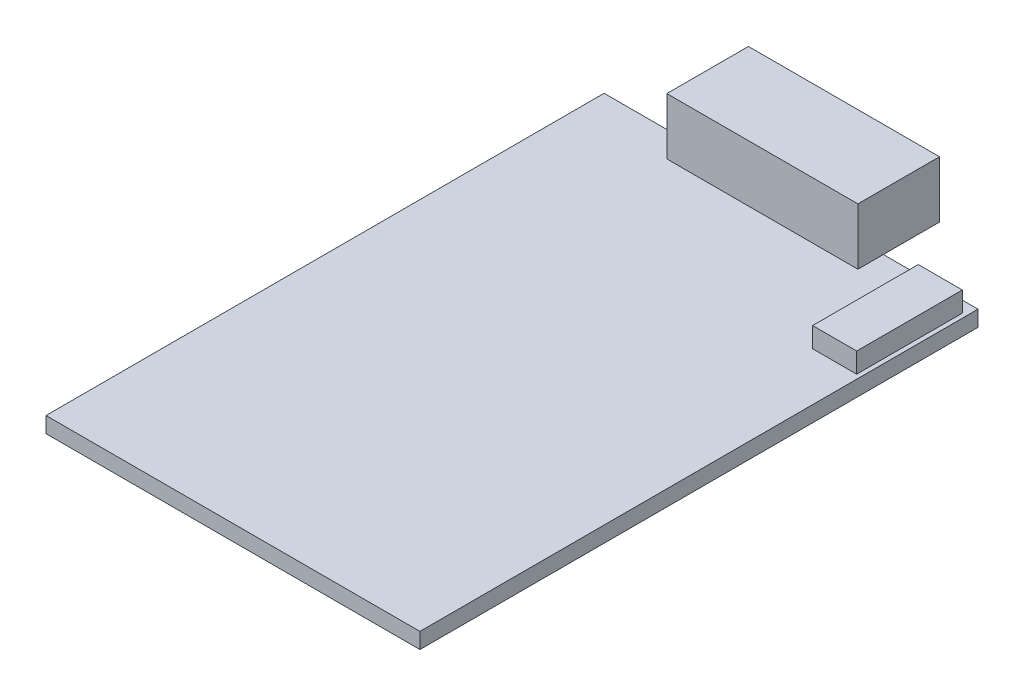
from build123d import *

# Parameters (mm, degrees)
SKETCH1_W           = 39.63
SKETCH1_H           = 59.15
BOSS_EXTRUDE1_DEPTH = 1.67
BOSS_EXTRUDE2_START = 1.67
SKETCH2_W           = 20.25
SKETCH2_H           = 8.65
BOSS_EXTRUDE2_DEPTH = 6
SKETCH3_W           = 4.67
SKETCH3_H           = 11.2
BOSS_EXTRUDE3_DEPTH = 3.8


with BuildPart() as part:
    # Sketch1 → Boss-Extrude1 (new body)
    with BuildSketch(Plane(origin=(0, 0, 0), x_dir=(1, 0, 0), z_dir=(0, 1, 0))):
        with Locations((19.815, 29.575)):
            Rectangle(SKETCH1_W, SKETCH1_H)
    extrude(amount=BOSS_EXTRUDE1_DEPTH)

    # Sketch2 → Boss-Extrude2 (add)
    with BuildSketch(Plane(origin=(0, 0, 0), x_dir=(1, 0, 0), z_dir=(0, 1, 0)).offset(BOSS_EXTRUDE2_START)):
        with Locations((19.475, 60.775)):
            Rectangle(SKETCH2_W, SKETCH2_H)
    extrude(amount=BOSS_EXTRUDE2_DEPTH)

    # Sketch3 → Boss-Extrude3 (add)
    with BuildSketch(Plane(origin=(0, 0, 0), x_dir=(1, 0, 0), z_dir=(0, 1, 0))):
        with Locations((36.835, 52.35)):
            Rectangle(SKETCH3_W, SKETCH3_H)
    extrude(amount=BOSS_EXTRUDE3_DEPTH)


solid = part.part
